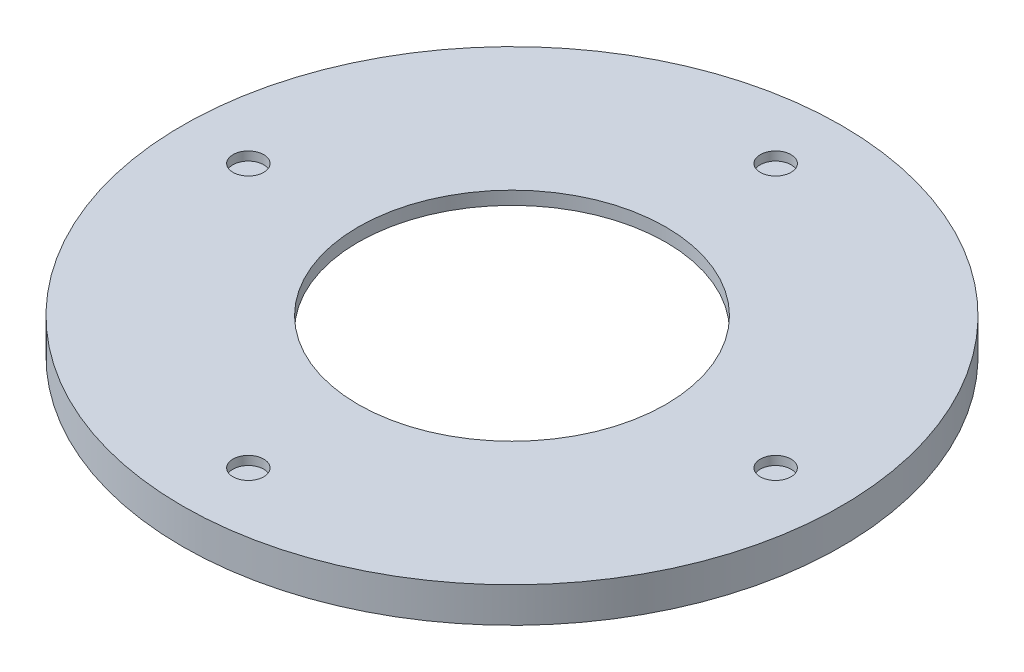
from build123d import *

# Parameters (mm, degrees)
SKETCH1_R           = 37.5
BOSS_EXTRUDE1_DEPTH = 4
SKETCH2_R           = 1.75
CUT_EXTRUDE1_DEPTH  = 1
SKETCH3_R           = 35
CUT_EXTRUDE5_DEPTH  = 2.5
SKETCH4_R           = 17.5
CUT_EXTRUDE6_DEPTH  = 54.091901454


with BuildPart() as part:
    # Sketch1 → Boss-Extrude1 (new body)
    with BuildSketch(Plane(origin=(0, 0, 0), x_dir=(1, 0, 0), z_dir=(0, 1, 0))):
        with Locations(Location((0, 0, 0), (0, 0, 270))):
            Circle(SKETCH1_R)
    extrude(amount=BOSS_EXTRUDE1_DEPTH)

    # Sketch2 → Cut-Extrude1 (cut)
    with BuildSketch(Plane(origin=(0, 4, 0), x_dir=(1, 0, 0), z_dir=(0, 1, 0))):
        with Locations(Location((0, 30, 0), (0, 0, 270))):
            Circle(SKETCH2_R)
        with Locations(Location((30, 0, 0), (0, 0, 270))):
            Circle(SKETCH2_R)
        with Locations(Location((0, -30, 0), (0, 0, 270))):
            Circle(SKETCH2_R)
        with Locations(Location((-30, 0, 0), (0, 0, 270))):
            Circle(SKETCH2_R)
    extrude(amount=-CUT_EXTRUDE1_DEPTH, mode=Mode.SUBTRACT)

    # Sketch3 → Cut-Extrude5 (cut)
    with BuildSketch(Plane(origin=(0, 0, 0), x_dir=(-1, 0, 0), z_dir=(0, -1, 0))):
        with Locations(Location((0, 0, 0), (0, 0, 90))):
            Circle(SKETCH3_R)
    extrude(amount=-CUT_EXTRUDE5_DEPTH, mode=Mode.SUBTRACT)

    # Sketch4 → Cut-Extrude6 (cut, through all)
    with BuildSketch(Plane(origin=(0, 2.5, 0), x_dir=(-1, 0, 0), z_dir=(0, -1, 0))):
        with Locations(Location((0, 0, 0), (0, 0, 90))):
            Circle(SKETCH4_R)
    extrude(amount=-CUT_EXTRUDE6_DEPTH, mode=Mode.SUBTRACT)


solid = part.part
